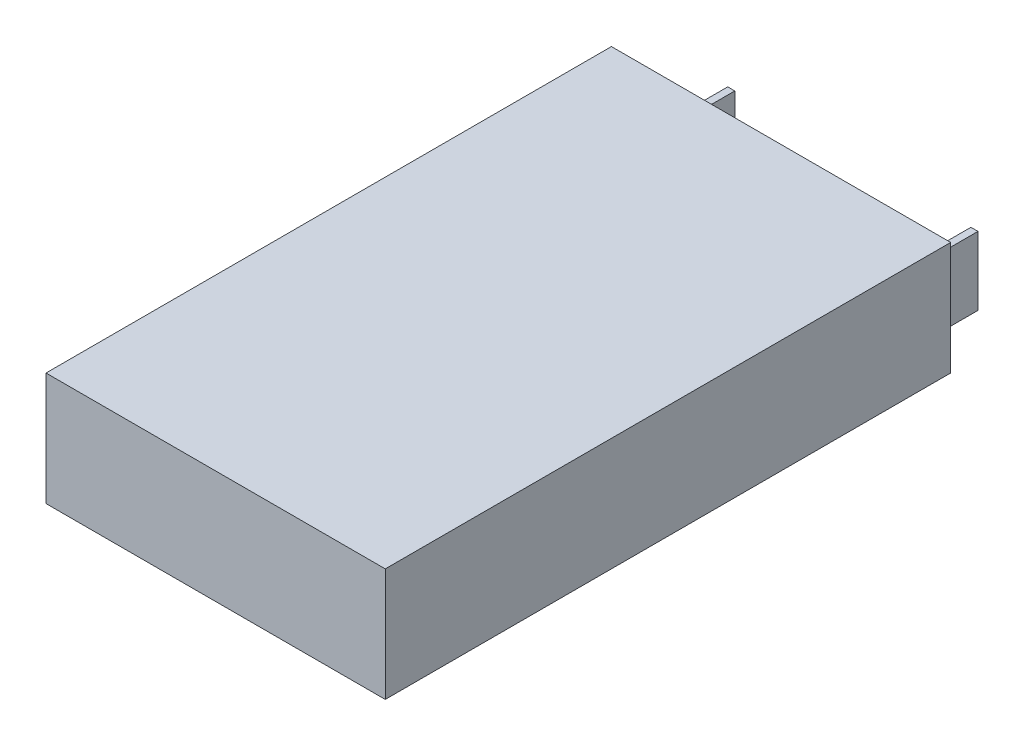
from build123d import *

# Parameters (mm, degrees)
BOSS_EXTRUDE1_DEPTH = 25.4
SKETCH5_W           = 1.5875
SKETCH5_H           = 15.37716
BOSS_EXTRUDE3_DEPTH = 15.24


with BuildPart() as part:
    # Sketch1 → Boss-Extrude1 (new body)
    with BuildSketch(Plane(origin=(0, 0, 0), x_dir=(1, 0, 0), z_dir=(0, 1, 0))):
        Polygon((38.1, 63.5), (28.9941, 63.5), (-28.9941, 63.5), (-38.1, 63.5), (-38.1, -63.5), (38.1, -63.5), align=None)
    extrude(amount=BOSS_EXTRUDE1_DEPTH)

    # Sketch5 → Boss-Extrude3 (add)
    with BuildSketch(Plane(origin=(0, 0, -63.5), x_dir=(-1, 0, 0), z_dir=(0, 0, -1))):
        with Locations((-28.20035, 7.68858)):
            Rectangle(SKETCH5_W, SKETCH5_H)
        with Locations((26.42680374, 7.68858)):
            Rectangle(SKETCH5_W, SKETCH5_H)
    extrude(amount=BOSS_EXTRUDE3_DEPTH)


solid = part.part
